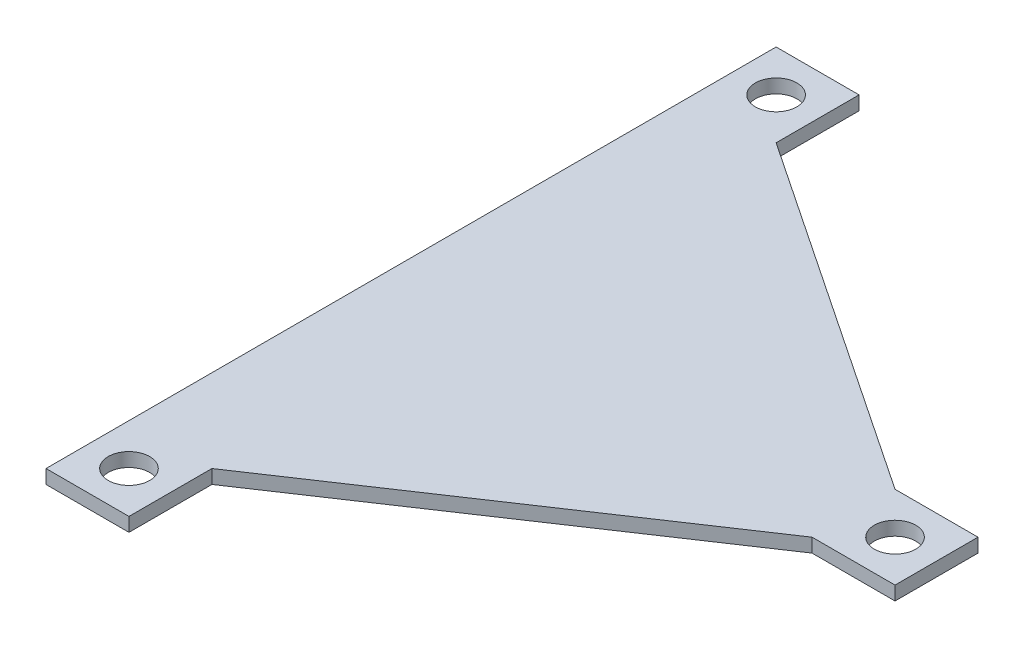
from build123d import *

# Parameters (mm, degrees)
CROQUIS1_R              = 1.5
SALIENTE_EXTRUIR1_DEPTH = 1
CORTAR_EXTRUIR1_DEPTH   = 1


with BuildPart() as part:
    # Croquis1 → Saliente-Extruir1 (new body)
    with BuildSketch(Plane(origin=(0, 0, 0), x_dir=(1, 0, 0), z_dir=(0, 1, 0))):
        Polygon((-3, 3), (-3, -49.8), (3, -49.8), (3, -43.8), (29, -26.4), (35, -26.4), (35, -20.4), (29, -20.4), (3, -3), (3, 3), align=None)
        with Locations(Location((0, 0, 0), (0, 0, 270))):
            Circle(CROQUIS1_R, mode=Mode.SUBTRACT)
        with Locations(Location((0, -46.8, 0), (0, 0, 270))):
            Circle(CROQUIS1_R, mode=Mode.SUBTRACT)
        with Locations(Location((32, -23.4, 0), (0, 0, 270))):
            Circle(CROQUIS1_R, mode=Mode.SUBTRACT)
    extrude(amount=SALIENTE_EXTRUIR1_DEPTH)

    # Croquis2 → Cortar-Extruir1 (cut)
    with BuildSketch(Plane(origin=(0, 4, 0), x_dir=(1, 0, 0), z_dir=(0, 1, 0))):
        Polygon((29, -20.4), (29, -26.4), (1.37887203, -65.195749652), (-23.269516781, -18.416533666), (-7.63010581, 16.328115394), align=None)
    extrude(amount=-CORTAR_EXTRUIR1_DEPTH, mode=Mode.SUBTRACT)


solid = part.part
